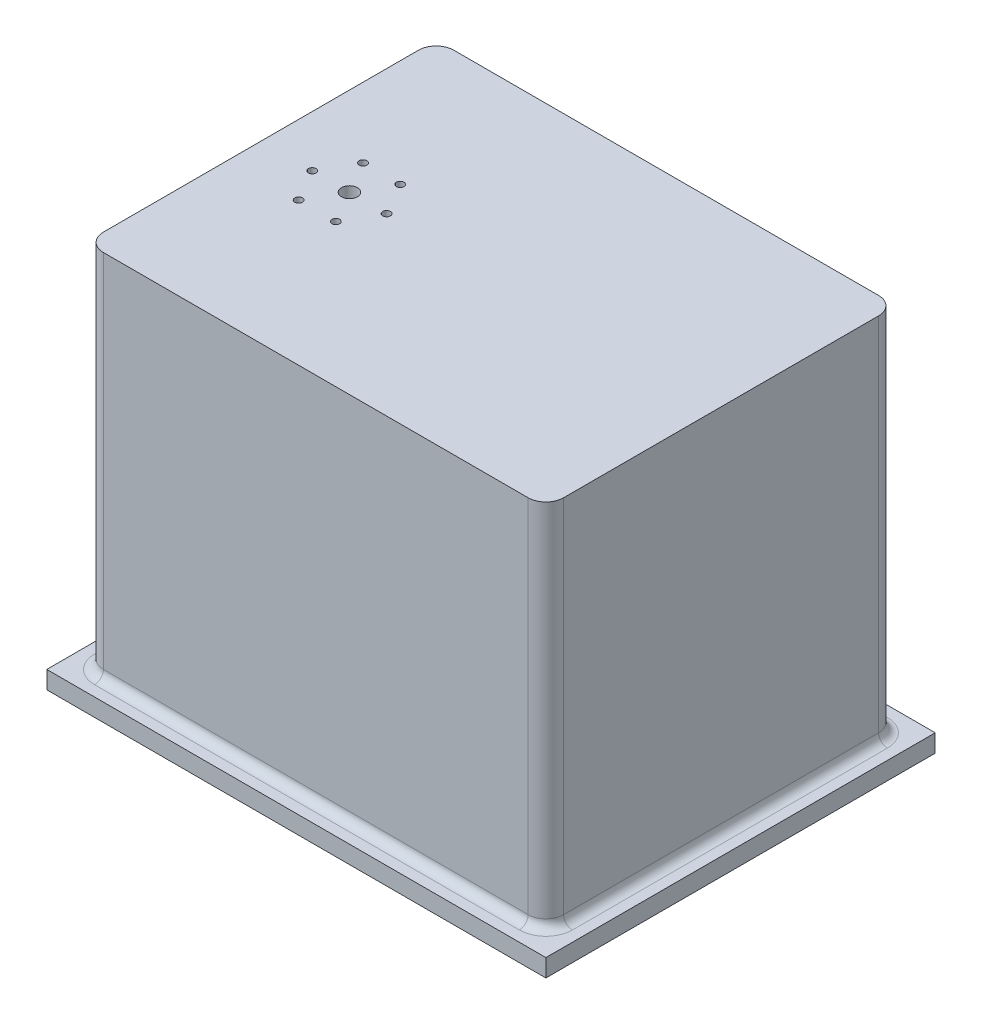
from build123d import *

# Parameters (mm, degrees)
SKETCH1_W           = 260
SKETCH1_H           = 198
BOSS_EXTRUDE1_DEPTH = 219
SKETCH2_W           = 240
SKETCH2_H           = 178
CUT_EXTRUDE1_DEPTH  = 209
SKETCH3_W           = 282
SKETCH3_H           = 220
SKETCH3_W_2         = 260
SKETCH3_H_2         = 198
BOSS_EXTRUDE2_DEPTH = 10
FILLET1_R           = 10
FILLET3_R           = 5
SKETCH4_R           = 2.17
SKETCH4_R_2         = 4.5
CUT_EXTRUDE3_DEPTH  = 20


with BuildPart() as part:
    # Sketch1 → Boss-Extrude1 (new body)
    with BuildSketch(Plane(origin=(0, 0, 0), x_dir=(1, 0, 0), z_dir=(0, 1, 0))):
        Rectangle(SKETCH1_W, SKETCH1_H)
    extrude(amount=BOSS_EXTRUDE1_DEPTH)

    # Sketch2 → Cut-Extrude1 (cut)
    with BuildSketch(Plane(origin=(0, 0, 0), x_dir=(1, 0, 0), z_dir=(0, 1, 0))):
        Rectangle(SKETCH2_W, SKETCH2_H)
    extrude(amount=CUT_EXTRUDE1_DEPTH, mode=Mode.SUBTRACT)

    # Sketch3 → Boss-Extrude2 (add)
    with BuildSketch(Plane(origin=(0, 0, 0), x_dir=(1, 0, 0), z_dir=(0, 1, 0))):
        Rectangle(SKETCH3_W, SKETCH3_H)
        Rectangle(SKETCH3_W_2, SKETCH3_H_2, mode=Mode.SUBTRACT)
    extrude(amount=BOSS_EXTRUDE2_DEPTH)

    # Fillet1
    fillet1_edges = [part.edges().sort_by_distance(p)[0] for p in [
        (-130, 114.5, -99),
        (130, 114.5, -99),
        (130, 114.5, 99),
        (-130, 114.5, 99),
    ]]
    fillet(fillet1_edges, radius=FILLET1_R)

    # Fillet3
    fillet3_edges = [part.edges().sort_by_distance(p)[0] for p in [
        (0, 10, -99),
        (130, 10, 0),
        (0, 10, 99),
        (-130, 10, 0),
        (127.071067812, 10, -96.071067812),
        (127.071067812, 10, 96.071067812),
        (-127.071067812, 10, -96.071067812),
        (-127.071067812, 10, 96.071067812),
    ]]
    fillet(fillet3_edges, radius=FILLET3_R)

    # Sketch4 → Cut-Extrude3 (cut)
    with BuildSketch(Plane(origin=(0, 219, 0), x_dir=(1, 0, 0), z_dir=(0, 1, 0))):
        with Locations(Location((-59, 0, 0), (0, 0, 270))):
            Circle(SKETCH4_R)
        with Locations(Location((-69.5, -18.186533479, 0), (0, 0, 270))):
            Circle(SKETCH4_R)
        with Locations(Location((-90.5, -18.186533479, 0), (0, 0, 270))):
            Circle(SKETCH4_R)
        with Locations(Location((-101, 0, 0), (0, 0, 270))):
            Circle(SKETCH4_R)
        with Locations(Location((-90.5, 18.186533479, 0), (0, 0, 270))):
            Circle(SKETCH4_R)
        with Locations(Location((-69.5, 18.186533479, 0), (0, 0, 270))):
            Circle(SKETCH4_R)
        with Locations(Location((-80, 0, 0), (0, 0, 270))):
            Circle(SKETCH4_R_2)
    extrude(amount=-CUT_EXTRUDE3_DEPTH, mode=Mode.SUBTRACT)


solid = part.part
